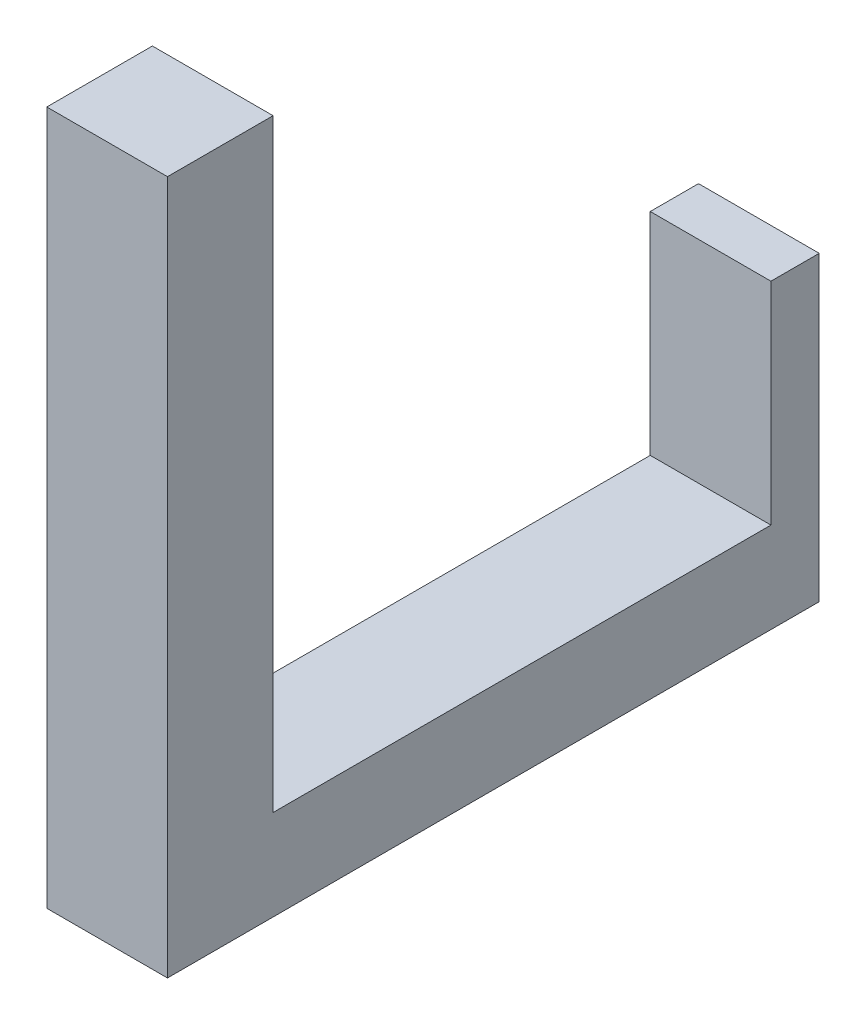
from build123d import *

# Parameters (mm, degrees)
SKETCH_1_W      = 40
SKETCH_1_H      = 16
EXTRUDE_1_DEPTH = 100
SKETCH_2_W      = 40
SKETCH_2_H      = 30
EXTRUDE_2_DEPTH = 200
SKETCH_3_W      = 40
SKETCH_3_H      = 35
EXTRUDE_3_DEPTH = 200


with BuildPart() as part:
    # 草图1 → 凸台-拉伸1 (new body)
    with BuildSketch(Plane(origin=(0, 0, 0), x_dir=(1, 0, 0), z_dir=(0, 1, 0))):
        Rectangle(SKETCH_1_W, SKETCH_1_H)
    extrude(amount=EXTRUDE_1_DEPTH)

    # 草图2 → 凸台-拉伸2 (add)
    with BuildSketch(Plane.XY.offset(8)):
        with Locations((0, 15)):
            Rectangle(SKETCH_2_W, SKETCH_2_H)
    extrude(amount=EXTRUDE_2_DEPTH)

    # 草图3 → 凸台-拉伸3 (add)
    with BuildSketch(Plane(origin=(0, 30, 0), x_dir=(1, 0, 0), z_dir=(0, 1, 0))):
        with Locations((0, -190.5)):
            Rectangle(SKETCH_3_W, SKETCH_3_H)
    extrude(amount=EXTRUDE_3_DEPTH)


solid = part.part
